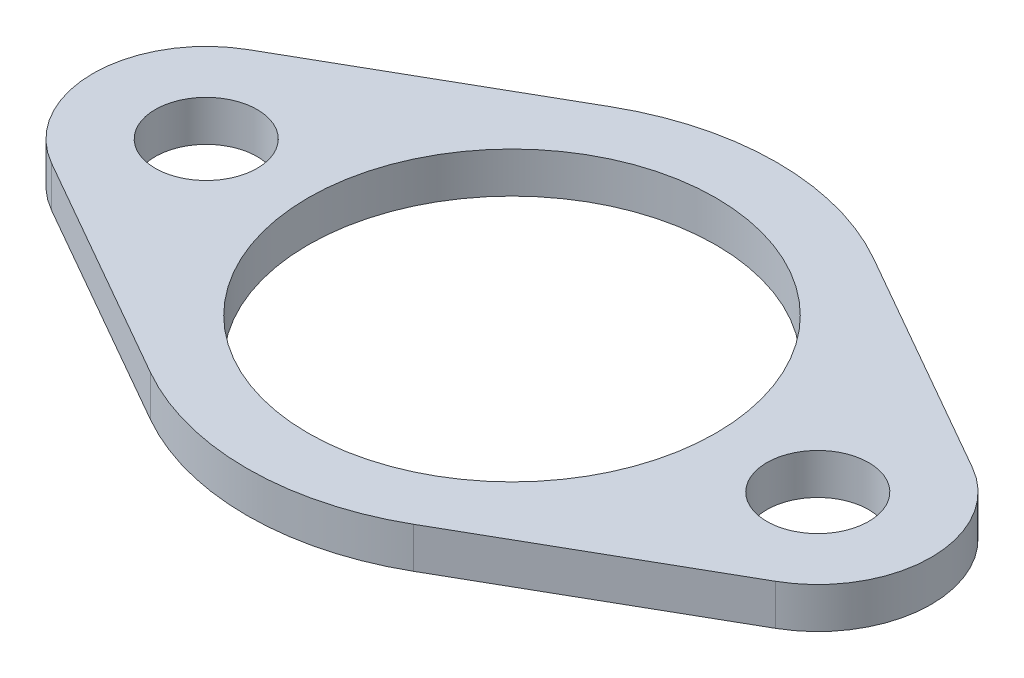
from build123d import *

# Parameters (mm, degrees)
SKETCH1_R           = 5
SKETCH1_R_2         = 1.25
BOSS_EXTRUDE1_DEPTH = 1


with BuildPart() as part:
    # Sketch1 → Boss-Extrude1 (new body)
    with BuildSketch(Plane(origin=(0, 0, 0), x_dir=(1, 0, 0), z_dir=(0, 1, 0))):
        with BuildLine():
            Line((-8.87888, 2.413936608), (-3.224, 5.644096385))
            ThreePointArc((-3.224, 5.644096385), (0, 6.5), (3.224, 5.644096385))
            Line((3.224, 5.644096385), (8.87888, 2.413936608))
            ThreePointArc((8.87888, 2.413936608), (10.28, 0), (8.87888, -2.413936608))
            Line((8.87888, -2.413936608), (3.224, -5.644096385))
            ThreePointArc((3.224, -5.644096385), (0, -6.5), (-3.224, -5.644096385))
            Line((-3.224, -5.644096385), (-8.87888, -2.413936608))
            ThreePointArc((-8.87888, -2.413936608), (-10.28, 0), (-8.87888, 2.413936608))
        make_face()
        with Locations(Location((0, 0, 0), (0, 0, 270))):
            Circle(SKETCH1_R, mode=Mode.SUBTRACT)
        with Locations(Location((-7.5, 0, 0), (0, 0, 270))):
            Circle(SKETCH1_R_2, mode=Mode.SUBTRACT)
        with Locations(Location((7.5, 0, 0), (0, 0, 90))):
            Circle(SKETCH1_R_2, mode=Mode.SUBTRACT)
    extrude(amount=BOSS_EXTRUDE1_DEPTH)


solid = part.part
